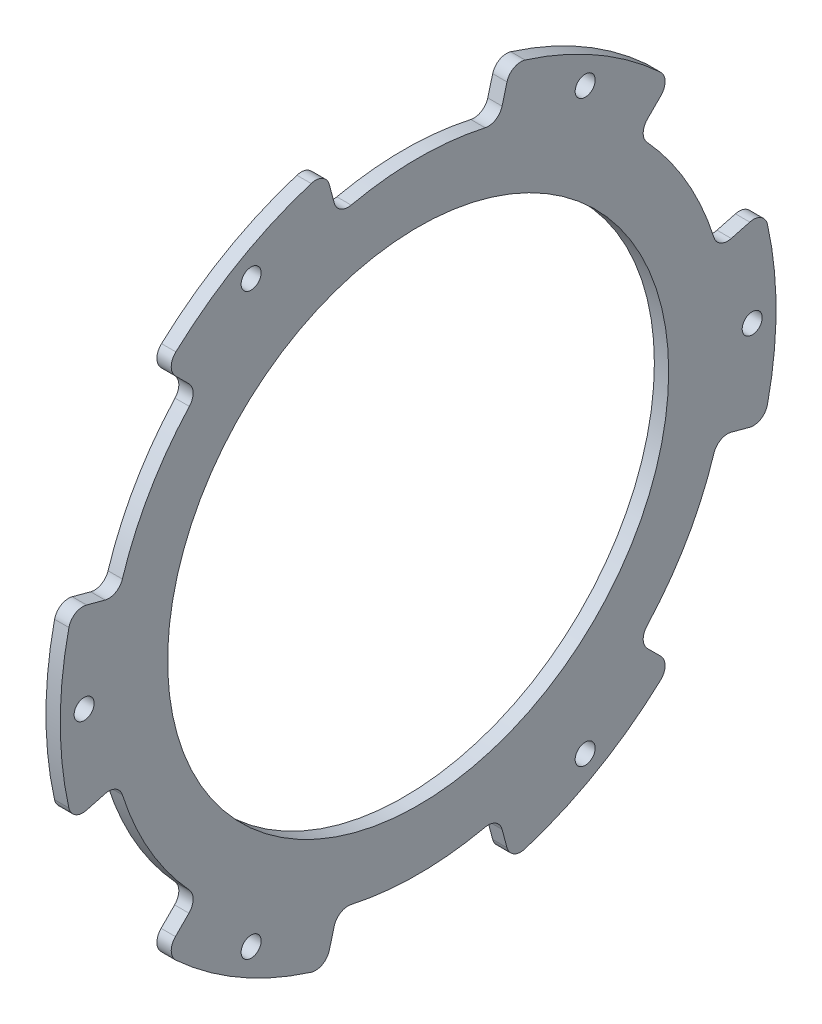
from build123d import *

# Parameters (mm, degrees)
SKETCH_2_R               = 2.807146676
EXTRUDE_2_DEPTH          = 3
SKETCH_3_R               = 52.5
CUT_EXTRUDE_1_DEPTH      = 3
EXTRUDE_START            = -3
SKETCH_4_R               = 2.807146676
SKETCH_4_R_2             = 2.1
EXTRUDE_3_DEPTH          = 3
PATTERN_CIRCULAR_1_COUNT = 6


with BuildPart() as part:
    # 草图2 → 凸台-拉伸2 (new body)
    with BuildSketch(Plane(origin=(0, 0, 0), x_dir=(0, 0, -1), z_dir=(1, 0, 0))):
        with BuildLine():
            Line((-60.415227383, 26.95696902), (-57.584197007, 24.125938644))
            ThreePointArc((-57.584197007, 24.125938644), (-56.706247683, 22.070810886), (-57.492674784, 19.978951059))
            ThreePointArc((-57.492674784, 19.978951059), (-65.839403755, 8.589494146), (-71.529598291, -4.333713637))
            ThreePointArc((-71.529598291, -4.333713637), (-72.947988492, -6.060709399), (-75.166756001, -6.32794686))
            Line((-75.166756001, -6.32794686), (-79.034015413, -5.291717824))
            ThreePointArc((-79.034015413, -5.291717824), (-81.364285194, -5.623240003), (-82.738085883, -7.534453196))
            ThreePointArc((-82.738085883, -7.534453196), (-84.547752509, -23.910505854), (-82.738085883, -40.286558511))
            ThreePointArc((-82.738085883, -40.286558511), (-81.364285194, -42.197771704), (-79.034015413, -42.529293884))
            Line((-79.034015413, -42.529293884), (-75.166756001, -41.493064847))
            ThreePointArc((-75.166756001, -41.493064847), (-72.947988492, -41.760302308), (-71.529598291, -43.48729807))
            ThreePointArc((-71.529598291, -43.48729807), (-65.839403755, -56.410505854), (-57.492674784, -67.799962766))
            ThreePointArc((-57.492674784, -67.799962766), (-56.706247683, -69.891822593), (-57.584197007, -71.946950351))
            Line((-57.584197007, -71.946950351), (-60.415227383, -74.777980727))
            ThreePointArc((-60.415227383, -74.777980727), (-61.293255644, -76.961814644), (-60.324996811, -79.107167538))
            ThreePointArc((-60.324996811, -79.107167538), (-47.047752509, -88.862411137), (-31.960841581, -95.483220195))
            ThreePointArc((-31.960841581, -95.483220195), (-29.618782059, -95.249080495), (-28.16654054, -93.396768757))
            Line((-28.16654054, -93.396768757), (-27.130311503, -89.529509345))
            ThreePointArc((-27.130311503, -89.529509345), (-25.789493318, -87.741619048), (-23.584676016, -87.376754982))
            ThreePointArc((-23.584676016, -87.376754982), (-9.547752509, -88.910505854), (4.489170997, -87.376754982))
            ThreePointArc((4.489170997, -87.376754982), (6.693988299, -87.741619048), (8.034806484, -89.529509345))
            Line((8.034806484, -89.529509345), (9.071035521, -93.396768757))
            ThreePointArc((9.071035521, -93.396768757), (10.52327704, -95.249080495), (12.865336562, -95.483220195))
            ThreePointArc((12.865336562, -95.483220195), (27.952247491, -88.862411137), (41.229491792, -79.107167538))
            ThreePointArc((41.229491792, -79.107167538), (42.197750625, -76.961814644), (41.319722364, -74.777980727))
            Line((41.319722364, -74.777980727), (38.488691988, -71.946950351))
            ThreePointArc((38.488691988, -71.946950351), (37.610742664, -69.891822593), (38.397169765, -67.799962766))
            ThreePointArc((38.397169765, -67.799962766), (46.743898737, -56.410505854), (52.434093272, -43.48729807))
            ThreePointArc((52.434093272, -43.48729807), (53.852483473, -41.760302308), (56.071250982, -41.493064847))
            Line((56.071250982, -41.493064847), (59.938510394, -42.529293884))
            ThreePointArc((59.938510394, -42.529293884), (62.268780175, -42.197771704), (63.642580864, -40.286558511))
            ThreePointArc((63.642580864, -40.286558511), (65.452247491, -23.910505854), (63.642580864, -7.534453196))
            ThreePointArc((63.642580864, -7.534453196), (62.268780175, -5.623240003), (59.938510394, -5.291717824))
            Line((59.938510394, -5.291717824), (56.071250982, -6.32794686))
            ThreePointArc((56.071250982, -6.32794686), (53.852483473, -6.060709399), (52.434093272, -4.333713637))
            ThreePointArc((52.434093272, -4.333713637), (46.743898737, 8.589494146), (38.397169765, 19.978951059))
            ThreePointArc((38.397169765, 19.978951059), (37.610742664, 22.070810886), (38.488691988, 24.125938644))
            Line((38.488691988, 24.125938644), (41.319722364, 26.95696902))
            ThreePointArc((41.319722364, 26.95696902), (42.197750625, 29.140802937), (41.229491792, 31.286155831))
            ThreePointArc((41.229491792, 31.286155831), (27.952247491, 41.04139943), (12.865336562, 47.662208488))
            ThreePointArc((12.865336562, 47.662208488), (10.52327704, 47.428068788), (9.071035521, 45.57575705))
            Line((9.071035521, 45.57575705), (8.034806484, 41.708497638))
            ThreePointArc((8.034806484, 41.708497638), (6.693988299, 39.92060734), (4.489170997, 39.555743275))
            ThreePointArc((4.489170997, 39.555743275), (-9.547752509, 41.089494146), (-23.584676016, 39.555743275))
            ThreePointArc((-23.584676016, 39.555743275), (-25.789493318, 39.92060734), (-27.130311503, 41.708497638))
            Line((-27.130311503, 41.708497638), (-28.16654054, 45.57575705))
            ThreePointArc((-28.16654054, 45.57575705), (-29.618782059, 47.428068788), (-31.960841581, 47.662208488))
            ThreePointArc((-31.960841581, 47.662208488), (-47.047752509, 41.04139943), (-60.324996811, 31.286155831))
            ThreePointArc((-60.324996811, 31.286155831), (-61.293255644, 29.140802937), (-60.415227383, 26.95696902))
        make_face()
        with Locations((-44.547752509, 36.711272411)):
            Circle(SKETCH_2_R, mode=Mode.SUBTRACT)
        with Locations((-79.547752509, -23.910505854)):
            Circle(SKETCH_2_R, mode=Mode.SUBTRACT)
        with Locations((-44.547752509, -84.532284119)):
            Circle(SKETCH_2_R, mode=Mode.SUBTRACT)
        with Locations((25.452247491, -84.532284119)):
            Circle(SKETCH_2_R, mode=Mode.SUBTRACT)
        with Locations((60.452247491, -23.910505854)):
            Circle(SKETCH_2_R, mode=Mode.SUBTRACT)
        with Locations((25.452247491, 36.711272411)):
            Circle(SKETCH_2_R, mode=Mode.SUBTRACT)
    extrude(amount=EXTRUDE_2_DEPTH)

    # 草图3 → 切除-拉伸1 (cut)
    with BuildSketch(Plane(origin=(3, 0, 0), x_dir=(0, 0, -1), z_dir=(1, 0, 0))):
        with Locations((-9.547752509, -23.910505854)):
            Circle(SKETCH_3_R)
    extrude(amount=-CUT_EXTRUDE_1_DEPTH, mode=Mode.SUBTRACT)

    # 草图4 → 凸台-拉伸3 (add)
    with BuildSketch(Plane(origin=(3, 0, 0), x_dir=(0, 0, -1), z_dir=(1, 0, 0)).offset(EXTRUDE_START)):
        with Locations((-44.547752509, 36.711272411)):
            Circle(SKETCH_4_R)
        with Locations((-44.547752509, 36.711272411)):
            Circle(SKETCH_4_R_2, mode=Mode.SUBTRACT)
    extrude_3 = extrude(amount=EXTRUDE_3_DEPTH)

    # 阵列(圆周)1: 凸台-拉伸3 ×6 about axis
    pattern_circular_1_axis = Axis((0, -23.910505854, 9.547752509), (1, 0, 0))
    for i in range(1, PATTERN_CIRCULAR_1_COUNT):
        add(extrude_3.rotate(pattern_circular_1_axis, i * 360 / PATTERN_CIRCULAR_1_COUNT))


solid = part.part
